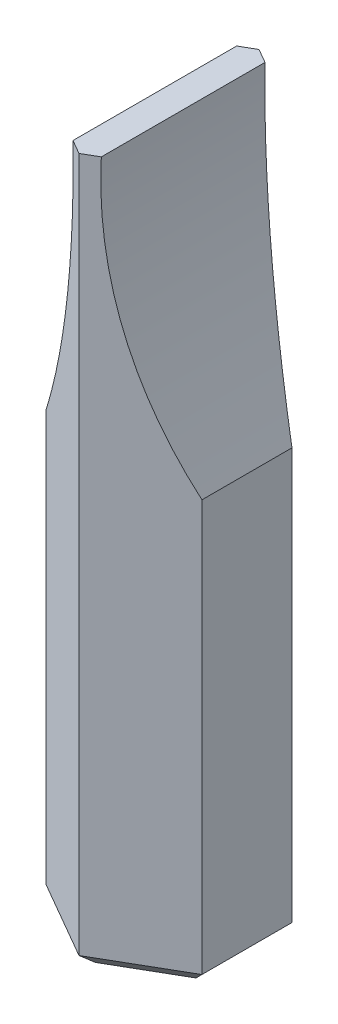
from build123d import *

# Parameters (mm, degrees)
BOSS_EXTRUDE1_DEPTH     = 25
CUT_EXTRUDE1_DEPTH      = 26.350366738
CUT_EXTRUDE1_DEPTH_BACK = 26.350366738
CHAMFER1_SIZE           = 0.5


with BuildPart() as part:
    # Sketch1 → Boss-Extrude1 (new body)
    with BuildSketch(Plane(origin=(0, 0, 0), x_dir=(1, 0, 0), z_dir=(0, 1, 0))):
        Polygon((0, 3.175), (-2.749630657, 1.5875), (-2.749630657, -1.5875), (0, -3.175), (2.749630657, -1.5875), (2.749630657, 1.5875), align=None)
    extrude(amount=BOSS_EXTRUDE1_DEPTH)

    # Sketch2 → Cut-Extrude1 (cut, two sides: drawn at the far end of the back side and taken through both)
    with BuildSketch(Plane.XY.offset(-CUT_EXTRUDE1_DEPTH_BACK)):
        with BuildLine():
            Line((-2.749630657, 25), (-0.5, 25))
            ThreePointArc((-0.5, 25), (-0.978721639, 19.854652783), (-2.749630657, 15))
            Line((-2.749630657, 15), (-2.749630657, 25))
        make_face()
        with BuildLine():
            Line((0.5, 25), (2.749630657, 25))
            Line((2.749630657, 25), (2.749630657, 15))
            ThreePointArc((2.749630657, 15), (0.978721639, 19.854652783), (0.5, 25))
        make_face()
    extrude(amount=CUT_EXTRUDE1_DEPTH + CUT_EXTRUDE1_DEPTH_BACK, mode=Mode.SUBTRACT)

    # Chamfer1
    chamfer1_edges = [part.edges().sort_by_distance(p)[0] for p in [
        (2.749630657, 0, 0),
        (1.374815329, 0, 2.38125),
        (-1.374815329, 0, 2.38125),
        (-2.749630657, 0, 0),
        (-1.374815329, 0, -2.38125),
        (1.374815329, 0, -2.38125),
    ]]
    chamfer(chamfer1_edges, length=CHAMFER1_SIZE)


solid = part.part
